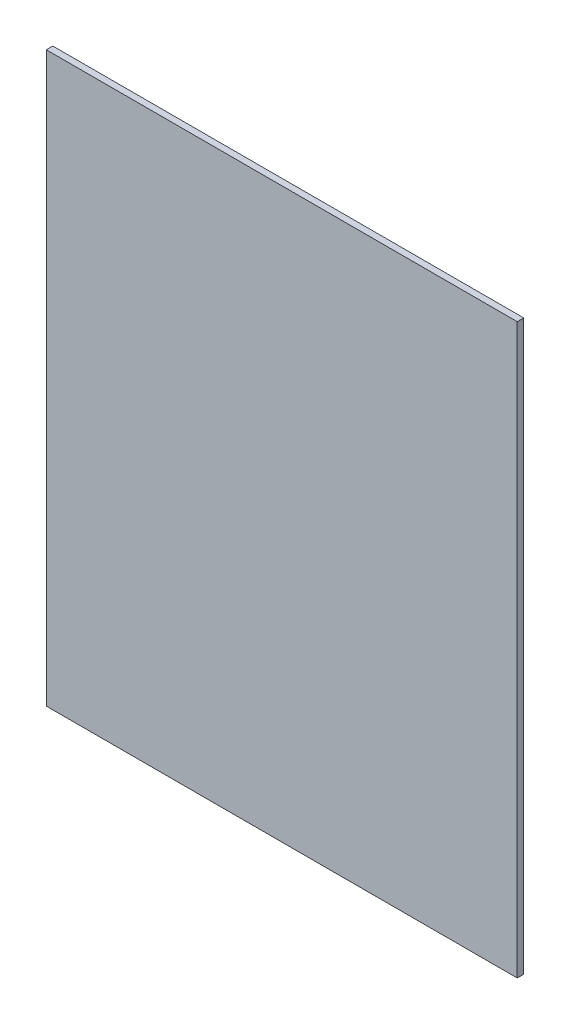
from build123d import *

# Parameters (mm, degrees)
SKETCH_1_W      = 14.5
SKETCH_1_H      = 17.5
EXTRUDE_1_DEPTH = 0.2


with BuildPart() as part:
    # 草图1 → 凸台-拉伸1 (new body)
    with BuildSketch(Plane.XY):
        Rectangle(SKETCH_1_W, SKETCH_1_H)
    extrude(amount=EXTRUDE_1_DEPTH)


solid = part.part
